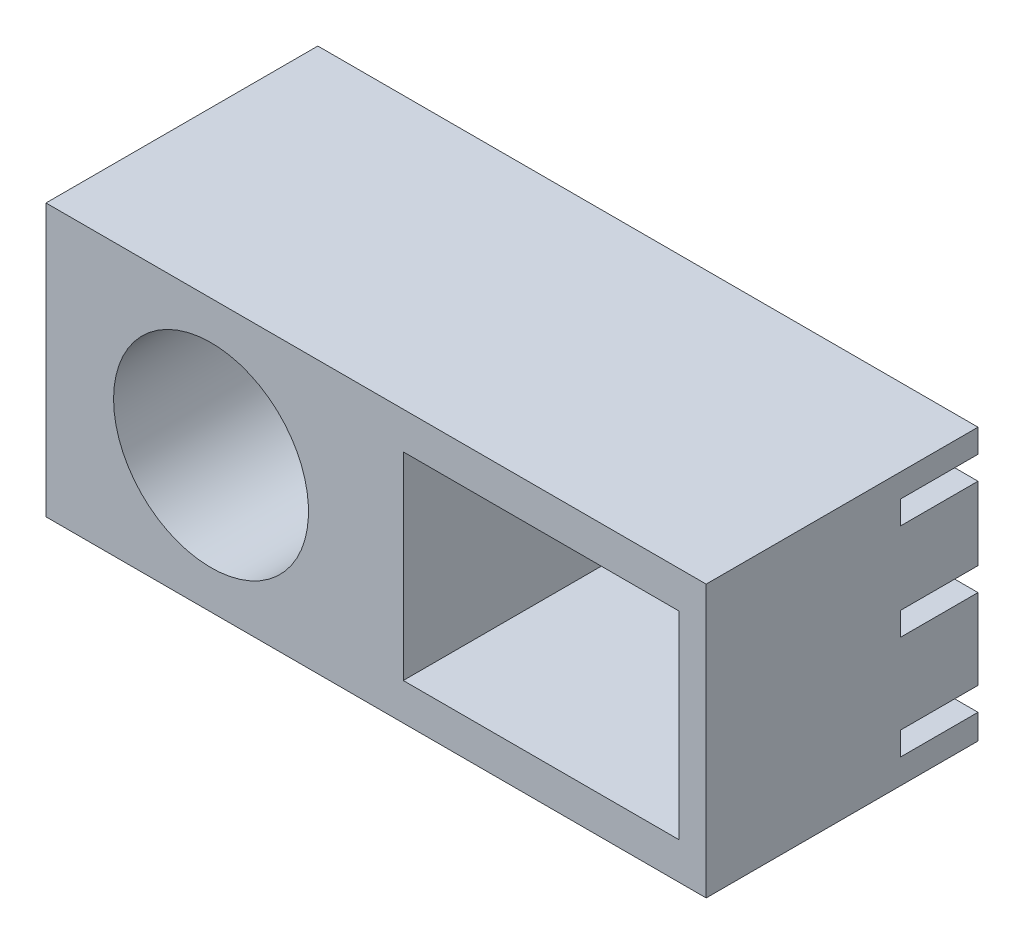
from build123d import *

# Parameters (mm, degrees)
CROQUIS1_W              = 17
CROQUIS1_H              = 7
SALIENTE_EXTRUIR1_DEPTH = 7
CROQUIS2_R              = 2.51
CROQUIS2_W              = 7.1
CROQUIS2_H              = 5.1
CORTAR_EXTRUIR2_DEPTH   = 7
CROQUIS4_W              = 0.7
CROQUIS4_H              = 0.6
CORTAR_EXTRUIR3_DEPTH   = 2
CROQUIS5_W              = 0.5
CROQUIS5_H              = 0.344672938
CROQUIS5_H_2            = 0.308474041
CORTAR_EXTRUIR4_DEPTH   = 2


with BuildPart() as part:
    # Croquis1 → Saliente-Extruir1 (new body)
    with BuildSketch(Plane.XY):
        with Locations((5.190566528, 3.234615385)):
            Rectangle(CROQUIS1_W, CROQUIS1_H)
    extrude(amount=SALIENTE_EXTRUIR1_DEPTH)

    # Croquis2 → Cortar-Extruir2 (cut)
    with BuildSketch(Plane(origin=(0, 0, 0), x_dir=(-1, 0, 0), z_dir=(0, 0, -1))):
        with Locations((-0.940566528, 3.234615385)):
            Circle(CROQUIS2_R)
        with Locations((-9.440566528, 3.234615385)):
            Rectangle(CROQUIS2_W, CROQUIS2_H)
    extrude(amount=-CORTAR_EXTRUIR2_DEPTH, mode=Mode.SUBTRACT)

    # Croquis4 → Cortar-Extruir3 (cut)
    with BuildSketch(Plane(origin=(0, 0, 0), x_dir=(-1, 0, 0), z_dir=(0, 0, -1))):
        with Locations((-13.340566528, 5.829288323)):
            Rectangle(CROQUIS4_W, CROQUIS4_H)
        with Locations((-13.340566528, 3.346068945)):
            Rectangle(CROQUIS4_W, CROQUIS4_H)
        with Locations((-13.340566528, 0.676141344)):
            Rectangle(CROQUIS4_W, CROQUIS4_H)
    extrude(amount=-CORTAR_EXTRUIR3_DEPTH, mode=Mode.SUBTRACT)

    # Croquis5 → Cortar-Extruir4 (cut)
    with BuildSketch(Plane(origin=(0, 0, 0), x_dir=(-1, 0, 0), z_dir=(0, 0, -1))):
        with Locations((-12.740566528, 5.956951854)):
            Rectangle(CROQUIS5_W, CROQUIS5_H)
        with Locations((-12.740566528, 0.530378365)):
            Rectangle(CROQUIS5_W, CROQUIS5_H_2)
    extrude(amount=-CORTAR_EXTRUIR4_DEPTH, mode=Mode.SUBTRACT)


solid = part.part
